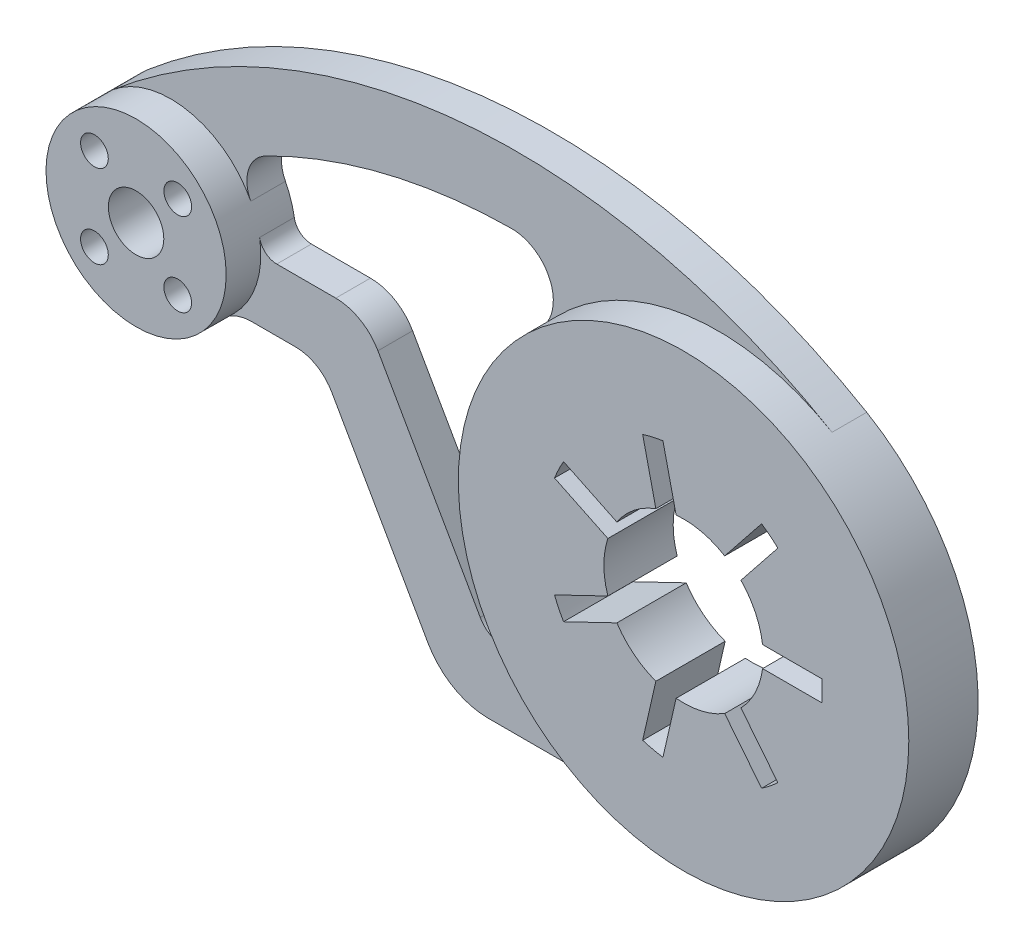
from build123d import *

# Parameters (mm, degrees)
EXTRUDE_1_DEPTH   = 10
EXTRUDE_1_2_DEPTH = 10
SKETCH_2_3_R      = 65
SKETCH_2_3_R_2    = 26
SKETCH_2_3_R_3    = 4
SKETCH_2_3_R_4    = 8
EXTRUDE_2_DEPTH   = 20


with BuildPart() as part:
    # Эскиз2 → Бобышка-Вытянуть1 (new body)
    with BuildSketch(Plane.XY):
        with BuildLine():
            Line((-66.371369906, -65), (0, -65))
            ThreePointArc((0, -65), (-30.089153243, -57.616341928), (-53.342367432, -37.142857143))
            ThreePointArc((-53.342367432, -37.142857143), (-53.013600163, -42.314550249), (-57.445626465, -45))
            Line((-57.445626465, -45), (-61.719917869, -45))
            ThreePointArc((-61.719917869, -45), (-65.741068408, -43.915948839), (-68.67243572, -40.957587084))
            Line((-68.67243572, -40.957587084), (-98.206043194, 10.925777398))
            ThreePointArc((-98.206043194, 10.925777398), (-103.335935989, 16.102910468), (-110.372949433, 18))
            Line((-110.372949433, 18), (-127.405882918, 18))
            ThreePointArc((-127.405882918, 18), (-130.643763547, 19.18999619), (-132.340417932, 22.193548387))
            ThreePointArc((-132.340417932, 22.193548387), (-133.797067988, 8.501680041), (-142.04160534, -2.526315789))
            ThreePointArc((-142.04160534, -2.526315789), (-138.569506528, -0.649136365), (-134.676192421, 0))
            Line((-134.676192421, 0), (-121.977178056, 0))
            ThreePointArc((-121.977178056, 0), (-115.945452247, -1.626076742), (-111.54840128, -6.063619373))
            Line((-111.54840128, -6.063619373), (-83.752664534, -54.893967711))
            ThreePointArc((-83.752664534, -54.893967711), (-76.424246255, -62.289872096), (-66.371369906, -65))
        make_face()
    extrude(amount=EXTRUDE_1_DEPTH)



with BuildPart() as body_2:
    # Эскиз2 → Extrude 1 2 (new body)
    with BuildSketch(Plane.XY):
        with BuildLine():
            ThreePointArc((-59.707166842, 60.765834645), (-48.770005737, 53.957911858), (-50.302314794, 41.166456325))
            ThreePointArc((-50.302314794, 41.166456325), (-11.477303942, 63.978679997), (32.856212496, 56.084483598))
            ThreePointArc((32.856212496, 56.084483598), (-73.921140449, 80.079620615), (-174.861132012, 37.791468547))
            ThreePointArc((-174.861132012, 37.791468547), (-152.986381903, 43.512029194), (-134.903213902, 29.93894769))
            ThreePointArc((-134.903213902, 29.93894769), (-135.536993635, 37.600652682), (-130.545808802, 43.448000294))
            ThreePointArc((-130.545808802, 43.448000294), (-96.126281422, 56.196575534), (-59.707166842, 60.765834645))
        make_face()
    extrude(amount=EXTRUDE_1_2_DEPTH)


with BuildPart() as part_1:
    add(part.part)

    add(body_2.part)  # Бобышка-Вытянуть2 merges body 2
    # Эскиз2<3> → Бобышка-Вытянуть2 (add)
    # profile 1 of 2: a face of its own
    with BuildSketch(Plane.XY):
        Circle(SKETCH_2_3_R)
        with BuildLine():
            Line((22.803508502, 3), (39.88734135, 3))
            ThreePointArc((39.88734135, 3), (40, 0), (39.88734135, -3))
            Line((39.88734135, -3), (22.803508502, -3))
            ThreePointArc((22.803508502, -3), (20.722283962, -9.979326), (16.563249445, -15.958031452))
            Line((16.563249445, -15.958031452), (27.214845003, -29.314709814))
            ThreePointArc((27.214845003, -29.314709814), (24.939592074, -31.273259299), (22.523856108, -33.055648625))
            Line((22.523856108, -33.055648625), (11.87226055, -19.698970263))
            ThreePointArc((11.87226055, -19.698970263), (5.117981481, -22.42334198), (-2.149474273, -22.899339736))
            Line((-2.149474273, -22.899339736), (-5.950984714, -39.554845227))
            ThreePointArc((-5.950984714, -39.554845227), (-8.900837358, -38.997116487), (-11.800552187, -38.219719623))
            Line((-11.800552187, -38.219719623), (-7.999041746, -21.564214132))
            ThreePointArc((-7.999041746, -21.564214132), (-14.340265443, -17.982124097), (-19.243600022, -12.596978138))
            Line((-19.243600022, -12.596978138), (-34.635601563, -20.009375412))
            ThreePointArc((-34.635601563, -20.009375412), (-36.038754716, -17.355349565), (-37.238903997, -14.603562205))
            Line((-37.238903997, -14.603562205), (-21.846902457, -7.19116493))
            ThreePointArc((-21.846902457, -7.19116493), (-23, 0), (-21.846902457, 7.19116493))
            Line((-21.846902457, 7.19116493), (-37.238903997, 14.603562205))
            ThreePointArc((-37.238903997, 14.603562205), (-36.038754716, 17.355349565), (-34.635601563, 20.009375412))
            Line((-34.635601563, 20.009375412), (-19.243600022, 12.596978138))
            ThreePointArc((-19.243600022, 12.596978138), (-14.340265443, 17.982124097), (-7.999041746, 21.564214132))
            Line((-7.999041746, 21.564214132), (-11.800552187, 38.219719623))
            ThreePointArc((-11.800552187, 38.219719623), (-8.900837358, 38.997116487), (-5.950984714, 39.554845227))
            Line((-5.950984714, 39.554845227), (-2.149474273, 22.899339736))
            ThreePointArc((-2.149474273, 22.899339736), (5.117981481, 22.42334198), (11.87226055, 19.698970263))
            Line((11.87226055, 19.698970263), (22.523856108, 33.055648625))
            ThreePointArc((22.523856108, 33.055648625), (24.939592074, 31.273259299), (27.214845003, 29.314709814))
            Line((27.214845003, 29.314709814), (16.563249445, 15.958031452))
            ThreePointArc((16.563249445, 15.958031452), (20.722283962, 9.979326), (22.803508502, 3))
        make_face(mode=Mode.SUBTRACT)
    # profile 2 of 2: a face of its own
    with BuildSketch(Plane.XY):
        with Locations((-158, 18)):
            Circle(SKETCH_2_3_R_2)
        with Locations((-170.02081528, 5.97918472)):
            Circle(SKETCH_2_3_R_3, mode=Mode.SUBTRACT)
        with Locations((-145.97918472, 5.97918472)):
            Circle(SKETCH_2_3_R_3, mode=Mode.SUBTRACT)
        with Locations((-158, 18)):
            Circle(SKETCH_2_3_R_4, mode=Mode.SUBTRACT)
        with Locations((-170.02081528, 30.02081528)):
            Circle(SKETCH_2_3_R_3, mode=Mode.SUBTRACT)
        with Locations((-145.97918472, 30.02081528)):
            Circle(SKETCH_2_3_R_3, mode=Mode.SUBTRACT)
    extrude(amount=EXTRUDE_2_DEPTH)


solid = part_1.part
